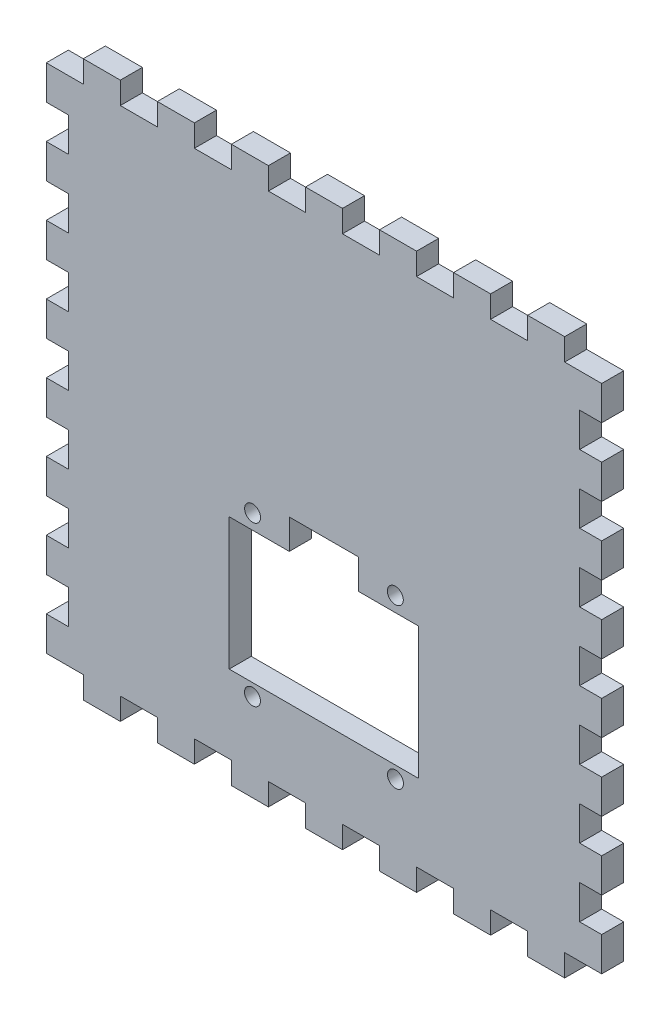
from build123d import *

# Parameters (mm, degrees)
SKETCH1_W               = 80
SKETCH1_H               = 80
BOSS_EXTRUDE1_DEPTH     = 3.175
CUT_EXTRUDE2_DEPTH      = 57.657573413
CUT_EXTRUDE2_DEPTH_BACK = 57.657573413
SKETCH3_W               = 5.333333333
SKETCH3_H               = 3.175
SKETCH3_W_2             = 3.175
SKETCH3_H_2             = 4.91
SKETCH3_W_3             = 5.333333334
SKETCH4_R               = 1.15
CUT_EXTRUDE3_DEPTH      = 57.657573413


with BuildPart() as part:
    # Sketch1 → Boss-Extrude1 (new body)
    with BuildSketch(Plane.XY):
        Rectangle(SKETCH1_W, SKETCH1_H)
    extrude(amount=BOSS_EXTRUDE1_DEPTH)

    # Sketch3 → Cut-Extrude2 (cut, two sides: drawn at the far end of the back side and taken through both)
    with BuildSketch(Plane.XY.offset(3.175).offset(-CUT_EXTRUDE2_DEPTH_BACK)):
        with Locations((-37.333333334, -38.4125)):
            Rectangle(SKETCH3_W, SKETCH3_H)
        with Locations((-26.666666666, -38.4125)):
            Rectangle(SKETCH3_W, SKETCH3_H)
        with Locations((-38.4125, -29.46)):
            Rectangle(SKETCH3_W_2, SKETCH3_H_2)
        with Locations((-16, -38.4125)):
            Rectangle(SKETCH3_W_3, SKETCH3_H)
        with Locations((-38.4125, -19.64)):
            Rectangle(SKETCH3_W_2, SKETCH3_H_2)
        with Locations((-5.333333334, -38.4125)):
            Rectangle(SKETCH3_W, SKETCH3_H)
        with Locations((-38.4125, -9.82)):
            Rectangle(SKETCH3_W_2, SKETCH3_H_2)
        with Locations((5.333333334, -38.4125)):
            Rectangle(SKETCH3_W, SKETCH3_H)
        with Locations((-38.4125, 0)):
            Rectangle(SKETCH3_W_2, SKETCH3_H_2)
        with Locations((16, -38.4125)):
            Rectangle(SKETCH3_W_3, SKETCH3_H)
        with Locations((-38.4125, 9.82)):
            Rectangle(SKETCH3_W_2, SKETCH3_H_2)
        with Locations((26.666666666, -38.4125)):
            Rectangle(SKETCH3_W, SKETCH3_H)
        with Locations((-38.4125, 19.64)):
            Rectangle(SKETCH3_W_2, SKETCH3_H_2)
        with Locations((37.333333334, -38.4125)):
            Rectangle(SKETCH3_W, SKETCH3_H)
        with Locations((-38.4125, 29.46)):
            Rectangle(SKETCH3_W_2, SKETCH3_H_2)
        with Locations((-37.333333334, 38.4125)):
            Rectangle(SKETCH3_W, SKETCH3_H)
        with Locations((38.4125, -29.46)):
            Rectangle(SKETCH3_W_2, SKETCH3_H_2)
        with Locations((38.4125, -19.64)):
            Rectangle(SKETCH3_W_2, SKETCH3_H_2)
        with Locations((-26.666666666, 38.4125)):
            Rectangle(SKETCH3_W, SKETCH3_H)
        with Locations((38.4125, -9.82)):
            Rectangle(SKETCH3_W_2, SKETCH3_H_2)
        with Locations((-16, 38.4125)):
            Rectangle(SKETCH3_W_3, SKETCH3_H)
        with Locations((38.4125, 0)):
            Rectangle(SKETCH3_W_2, SKETCH3_H_2)
        with Locations((-5.333333334, 38.4125)):
            Rectangle(SKETCH3_W, SKETCH3_H)
        with Locations((38.4125, 9.82)):
            Rectangle(SKETCH3_W_2, SKETCH3_H_2)
        with Locations((5.333333334, 38.4125)):
            Rectangle(SKETCH3_W, SKETCH3_H)
        with Locations((38.4125, 19.64)):
            Rectangle(SKETCH3_W_2, SKETCH3_H_2)
        with Locations((16, 38.4125)):
            Rectangle(SKETCH3_W_3, SKETCH3_H)
        with Locations((38.4125, 29.46)):
            Rectangle(SKETCH3_W_2, SKETCH3_H_2)
        with Locations((26.666666666, 38.4125)):
            Rectangle(SKETCH3_W, SKETCH3_H)
        with Locations((37.333333334, 38.4125)):
            Rectangle(SKETCH3_W, SKETCH3_H)
    extrude(amount=CUT_EXTRUDE2_DEPTH + CUT_EXTRUDE2_DEPTH_BACK, mode=Mode.SUBTRACT)

    # Sketch4 → Cut-Extrude3 (cut, through all)
    with BuildSketch(Plane.XY.offset(3.175)):
        with Locations((-10.28, -4.475)):
            Circle(SKETCH4_R)
        with Locations((-10.3, -27.375)):
            Circle(SKETCH4_R)
        with Locations(Location((10.3, -27.375, 0), (0, 0, 180))):
            Circle(SKETCH4_R)
        with Locations(Location((10.28, -4.475, 0), (0, 0, 180))):
            Circle(SKETCH4_R)
        Polygon((5, -2.325), (5, -6.625), (13.65, -6.625), (13.65, -25.625), (-13.65, -25.625), (-13.65, -6.625), (-5, -6.625), (-5, -2.325), align=None)
    extrude(amount=-CUT_EXTRUDE3_DEPTH, mode=Mode.SUBTRACT)


solid = part.part
